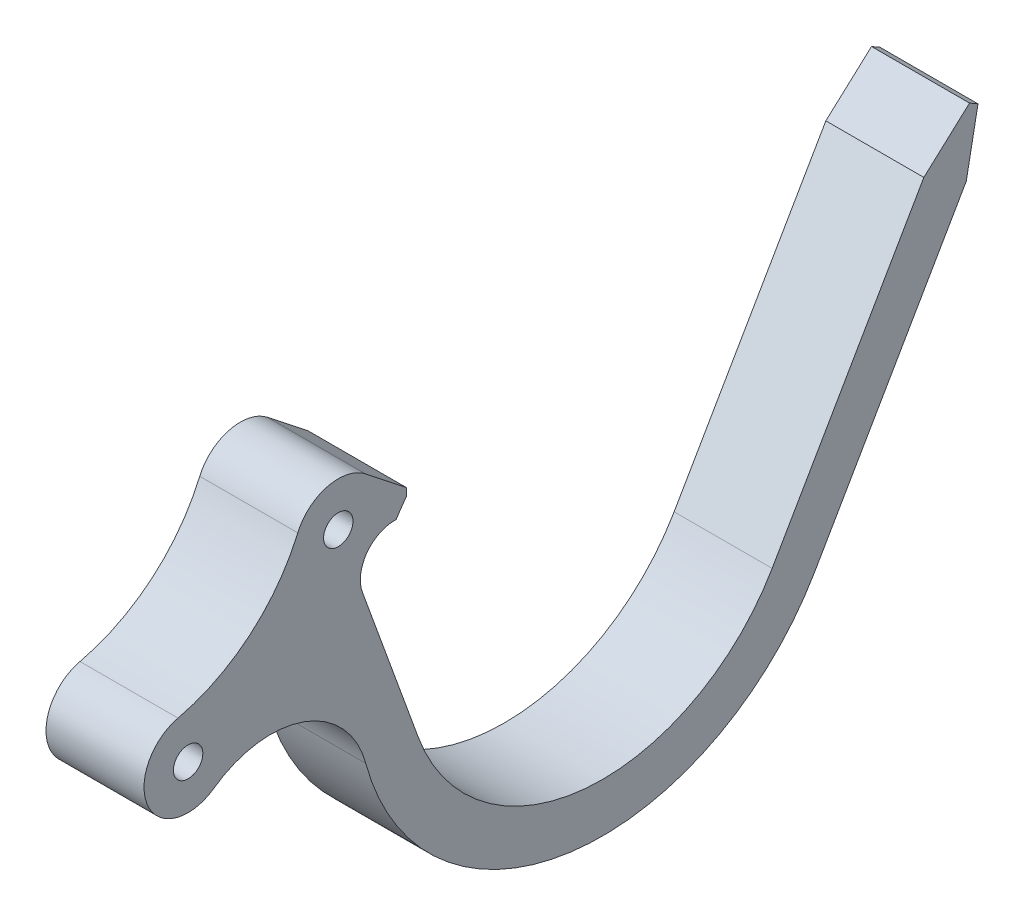
from build123d import *

# Parameters (mm, degrees)
SKETCH_1_R      = 1.5
EXTRUDE_2_DEPTH = 10


with BuildPart() as part:
    # 草图1 → 凸台-拉伸2 (new body)
    with BuildSketch(Plane(origin=(0, 0, 0), x_dir=(0, 0, -1), z_dir=(1, 0, 0))):
        with BuildLine():
            ThreePointArc((17.320508076, -10), (-1.743114855, -19.923893962), (-18.793852416, -6.840402867))
            Line((-18.793852416, -6.840402867), (-24.485520572, 8.797326871))
            ThreePointArc((-24.485520572, 8.797326871), (-24.06362866, 12.001914989), (-21.196596456, 13.494397531))
            Line((-21.196596456, 13.494397531), (-21.045218822, 13.494397531))
            ThreePointArc((-21.045218822, 13.494397531), (-20.53641173, 14.256780606), (-20, 15))
            Line((-20, 15), (-20, 15.803944373))
            Line((-20, 15.803944373), (-24.155954344, 19.087967936))
            ThreePointArc((-24.155954344, 19.087967936), (-28.049684886, 19.919774087), (-31.079320854, 17.336298731))
            ThreePointArc((-31.079320854, 17.336298731), (-35.972771838, 10.757774611), (-43.301092247, 7.081014883))
            ThreePointArc((-43.301092247, 7.081014883), (-46.36357592, 0.839616609), (-39.647678535, -0.957765092))
            ThreePointArc((-39.647678535, -0.957765092), (-30.443187857, 0.329762523), (-24.14010081, -6.500425592))
            ThreePointArc((-24.14010081, -6.500425592), (-3.247781267, -24.788140649), (21.650635095, -12.5))
            Line((21.650635095, -12.5), (37.127801325, 14.307238269))
            Line((37.127801325, 14.307238269), (38.323661657, 20.544349721))
            Line((38.323661657, 20.544349721), (37.457636253, 21.044349721))
            Line((37.457636253, 21.044349721), (32.797674306, 16.807238269))
            Line((32.797674306, 16.807238269), (17.320508076, -10))
        make_face()
        with Locations((-26.945927107, 15.557238269)):
            Circle(SKETCH_1_R, mode=Mode.SUBTRACT)
        with Locations((-42.266815969, 2.701486075)):
            Circle(SKETCH_1_R, mode=Mode.SUBTRACT)
    extrude(amount=EXTRUDE_2_DEPTH)


solid = part.part
